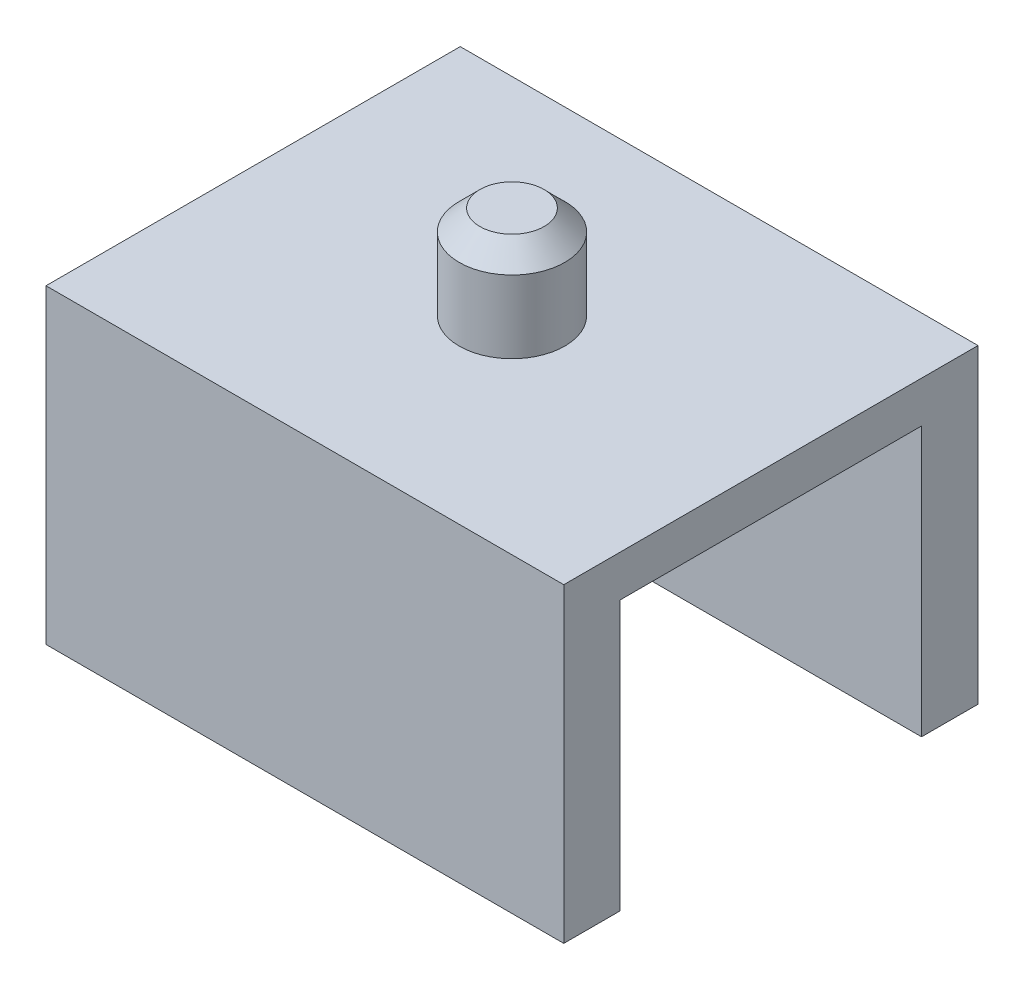
from build123d import *

# Parameters (mm, degrees)
SKETCH1_W           = 25
SKETCH1_H           = 15
BOSS_EXTRUDE1_DEPTH = 20
SKETCH2_W           = 25
SKETCH2_H           = 14.55
CUT_EXTRUDE1_DEPTH  = 13
SKETCH4_R           = 2.55
BOSS_EXTRUDE2_DEPTH = 4.5
CHAMFER1_SIZE       = 1
SKETCH5_R           = 1.25
BOSS_EXTRUDE3_DEPTH = 2.5
CHAMFER2_SIZE       = 1


with BuildPart() as part:
    # Sketch1 → Boss-Extrude1 (new body)
    with BuildSketch(Plane.XY):
        with Locations((12.5, 7.5)):
            Rectangle(SKETCH1_W, SKETCH1_H)
    extrude(amount=BOSS_EXTRUDE1_DEPTH)

    # Sketch2 → Cut-Extrude1 (cut)
    with BuildSketch(Plane.XZ):
        with Locations((12.5, 10)):
            Rectangle(SKETCH2_W, SKETCH2_H)
    extrude(amount=-CUT_EXTRUDE1_DEPTH, mode=Mode.SUBTRACT)

    # Sketch4 → Boss-Extrude2 (add)
    with BuildSketch(Plane(origin=(0, 15, 0), x_dir=(1, 0, 0), z_dir=(0, 1, 0))):
        with Locations(Location((12.5, -10, 0), (0, 0, 270))):
            Circle(SKETCH4_R)
    extrude(amount=BOSS_EXTRUDE2_DEPTH)

    # Chamfer1
    chamfer1_edges = [part.edges().sort_by_distance(p)[0] for p in [
        (12.5, 19.5, 7.45),
    ]]
    chamfer(chamfer1_edges, length=CHAMFER1_SIZE)

    # Sketch5 → Boss-Extrude3 (add)
    with BuildSketch(Plane(origin=(0, 13, 0), x_dir=(-1, 0, 0), z_dir=(0, -1, 0))):
        with Locations(Location((-12.5, -10, 0), (0, 0, 180))):
            Circle(SKETCH5_R)
    extrude(amount=BOSS_EXTRUDE3_DEPTH)

    # Chamfer2
    chamfer2_edges = [part.edges().sort_by_distance(p)[0] for p in [
        (11.25, 10.5, 10),
    ]]
    chamfer(chamfer2_edges, length=CHAMFER2_SIZE)


solid = part.part
